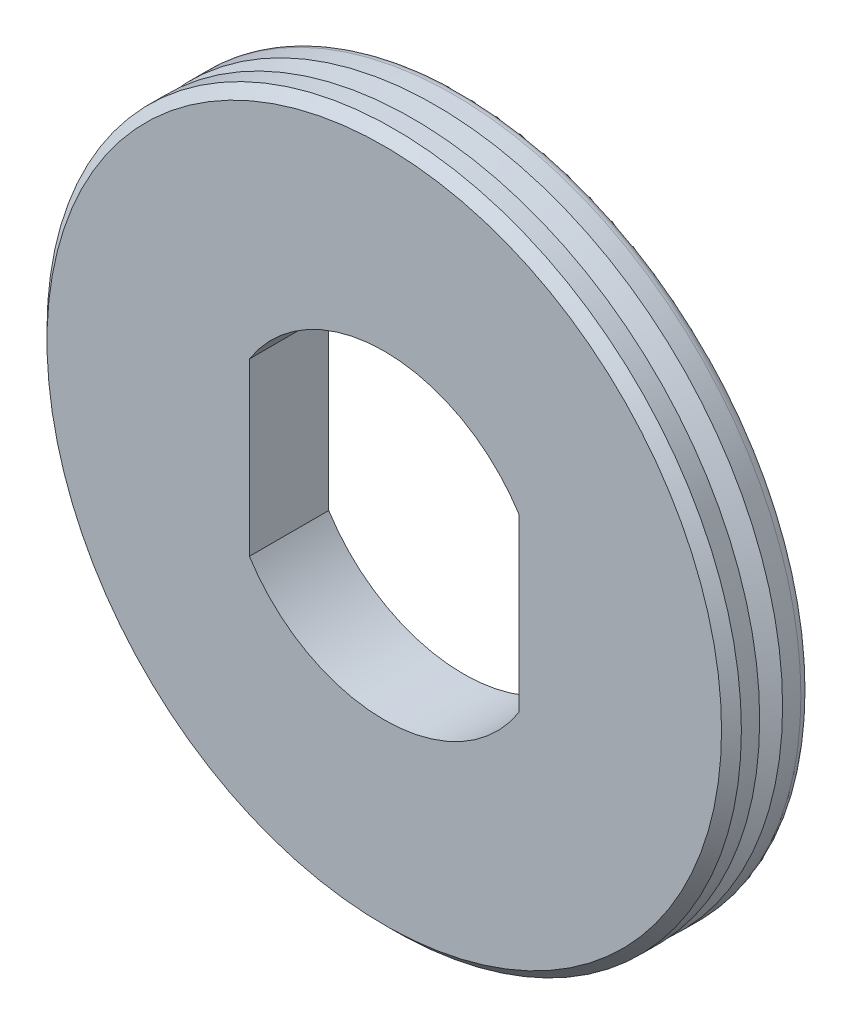
from build123d import *

# Parameters (mm, degrees)
SKETCH_1_R      = 17.5
EXTRUDE_2_DEPTH = 2
CHAMFER_1_SIZE  = 0.5
FILLET_2_R      = 0.5


with BuildPart() as part:
    # Эскиз1 → Бобышка-Вытянуть2 (new, symmetric)
    with BuildSketch(Plane.XY):
        Circle(SKETCH_1_R)
        with BuildLine():
            Line((6.8, 4.308421985), (6.8, -4.308421985))
            ThreePointArc((6.8, -4.308421985), (0, -8.05), (-6.8, -4.308421985))
            Line((-6.8, -4.308421985), (-6.8, 4.308421985))
            ThreePointArc((-6.8, 4.308421985), (0, 8.05), (6.8, 4.308421985))
        make_face(mode=Mode.SUBTRACT)
    extrude(amount=EXTRUDE_2_DEPTH, both=True)

    # Эскиз2 → Вырез-Повернуть1 (revolve, cut)
    with BuildSketch(Plane(origin=(0, 0, 0), x_dir=(0, 0, -1), z_dir=(1, 0, 0)), mode=Mode.PRIVATE) as cut_revolve_1_sk:
        Polygon((-0.577350269, 17.5), (0.577350269, 17.5), (0, 16.5), align=None)
    revolve(cut_revolve_1_sk.sketch.rotate(Axis((0, 0, 3.24866267), (0, 0, -1)), 90), axis=Axis((0, 0, 3.24866267), (0, 0, -1)), mode=Mode.SUBTRACT)

    # Фаска1
    chamfer_1_edges = [part.edges().sort_by_distance(p)[0] for p in [
        (-17.5, 0, 2),
    ]]
    chamfer(chamfer_1_edges, length=CHAMFER_1_SIZE)

    # Скругление2
    fillet_2_edges = [part.edges().sort_by_distance(p)[0] for p in [
        (-17.5, 0, -2),
    ]]
    fillet(fillet_2_edges, radius=FILLET_2_R)


solid = part.part
